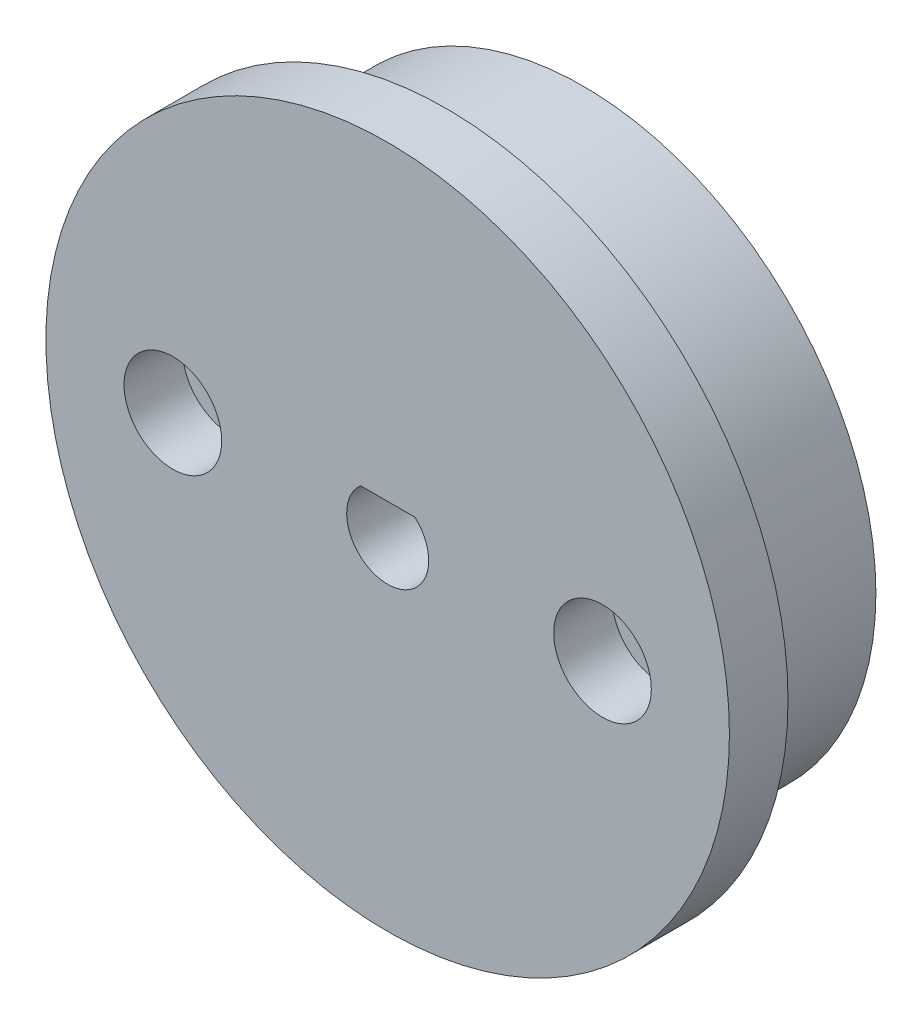
from build123d import *

# Parameters (mm, degrees)
SKETCH1_R           = 15
BOSS_EXTRUDE1_DEPTH = 7
SKETCH2_R           = 17.5
BOSS_EXTRUDE2_DEPTH = 3
SKETCH3_R           = 1.5
CUT_EXTRUDE1_DEPTH  = 10
SKETCH5_R           = 2.5
CUT_EXTRUDE3_DEPTH  = 3
CUT_EXTRUDE5_DEPTH  = 10


with BuildPart() as part:
    # Sketch1 → Boss-Extrude1 (new body)
    with BuildSketch(Plane.XY):
        Circle(SKETCH1_R)
    extrude(amount=BOSS_EXTRUDE1_DEPTH)

    # Sketch2 → Boss-Extrude2 (add)
    with BuildSketch(Plane.XY.offset(7)):
        Circle(SKETCH2_R)
    extrude(amount=BOSS_EXTRUDE2_DEPTH)

    # Sketch3 → Cut-Extrude1 (cut)
    with BuildSketch(Plane.XY.offset(10)):
        with Locations((-11, 0)):
            Circle(SKETCH3_R)
        with Locations((11, 0)):
            Circle(SKETCH3_R)
    extrude(amount=-CUT_EXTRUDE1_DEPTH, mode=Mode.SUBTRACT)

    # Sketch5 → Cut-Extrude3 (cut)
    with BuildSketch(Plane.XY.offset(10)):
        with Locations((11, 0)):
            Circle(SKETCH5_R)
        with Locations((-11, 0)):
            Circle(SKETCH5_R)
    extrude(amount=-CUT_EXTRUDE3_DEPTH, mode=Mode.SUBTRACT)

    # Sketch4 → Cut-Extrude5 (cut)
    with BuildSketch(Plane.XY.offset(10)):
        with BuildLine():
            Line((-1.389019438, 1.575), (1.389019438, 1.575))
            ThreePointArc((1.389019438, 1.575), (0, -2.1), (-1.389019438, 1.575))
        make_face()
    extrude(amount=-CUT_EXTRUDE5_DEPTH, mode=Mode.SUBTRACT)


solid = part.part
